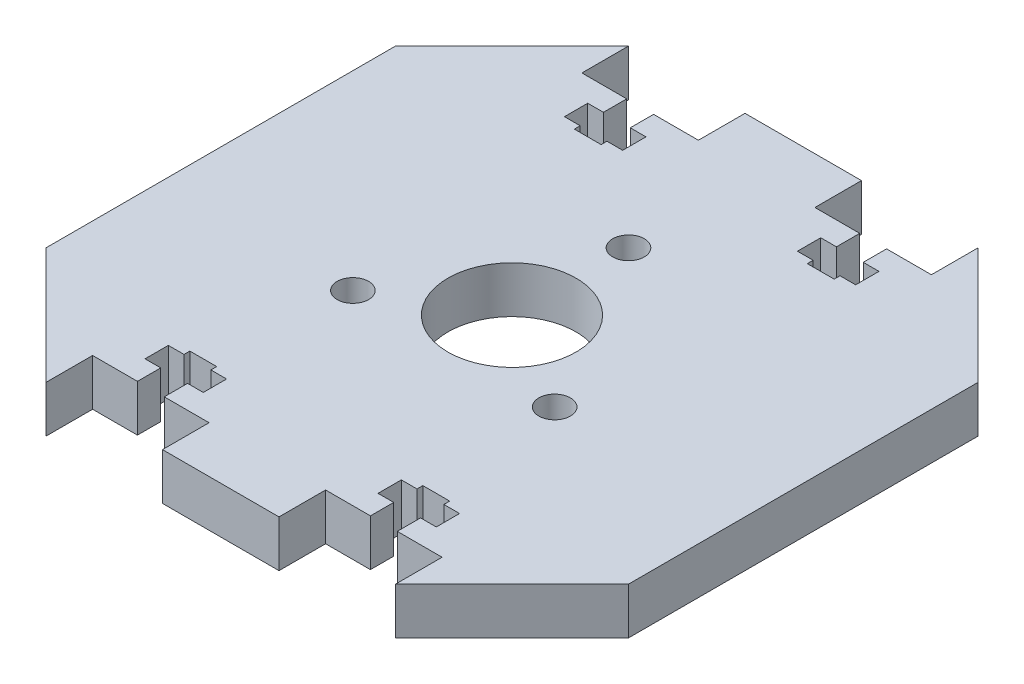
from build123d import *

# Parameters (mm, degrees)
SKETCH1_R           = 2.15265
SKETCH1_R_2         = 8.73125
BOSS_EXTRUDE1_DEPTH = 6.35
CUT_EXTRUDE1_DEPTH  = 57.484668827


with BuildPart() as part:
    # Sketch1 → Boss-Extrude1 (new body)
    with BuildSketch(Plane(origin=(0, 0, 0), x_dir=(1, 0, 0), z_dir=(0, 1, 0))):
        Polygon((23.8125, 39.6875), (-23.8125, 39.6875), (-39.6875, 23.8125), (-39.6875, -23.8125), (-23.8125, -39.6875), (23.8125, -39.6875), (39.6875, -23.8125), (39.6875, 23.8125), align=None)
        with Locations(Location((-13.748153285, -7.9375, 0), (0, 0, 270))):
            Circle(SKETCH1_R, mode=Mode.SUBTRACT)
        with Locations(Location((13.748153285, -7.9375, 0), (0, 0, 270))):
            Circle(SKETCH1_R, mode=Mode.SUBTRACT)
        with Locations(Location((0, 0, 0), (0, 0, 270))):
            Circle(SKETCH1_R_2, mode=Mode.SUBTRACT)
        with Locations(Location((0, 15.875, 0), (0, 0, 270))):
            Circle(SKETCH1_R, mode=Mode.SUBTRACT)
    extrude(amount=BOSS_EXTRUDE1_DEPTH)

    # Sketch2 → Cut-Extrude1 (cut, through all)
    with BuildSketch(Plane(origin=(0, 6.35, 0), x_dir=(1, 0, 0), z_dir=(0, 1, 0))):
        Polygon((-7.9375, 39.6875), (-23.8125, 39.6875), (-23.8125, 33.3375), (-17.7038, 33.3375), (-17.7038, 30.1625), (-19.84375, 30.1625), (-19.84375, 26.9875), (-17.7038, 26.9875), (-17.7038, 26.19375), (-14.0462, 26.19375), (-14.0462, 26.9875), (-11.90625, 26.9875), (-11.90625, 30.1625), (-14.0462, 30.1625), (-14.0462, 33.3375), (-7.9375, 33.3375), align=None)
        Polygon((23.8125, 39.6875), (7.9375, 39.6875), (7.9375, 33.3375), (14.0462, 33.3375), (14.0462, 30.1625), (11.90625, 30.1625), (11.90625, 26.9875), (14.0462, 26.9875), (14.0462, 26.19375), (17.7038, 26.19375), (17.7038, 26.9875), (19.84375, 26.9875), (19.84375, 30.1625), (17.7038, 30.1625), (17.7038, 33.3375), (23.8125, 33.3375), align=None)
        Polygon((-23.8125, -33.3375), (-23.8125, -39.6875), (-7.9375, -39.6875), (-7.9375, -33.3375), (-14.0462, -33.3375), (-14.0462, -30.1625), (-11.90625, -30.1625), (-11.90625, -26.9875), (-14.0462, -26.9875), (-14.0462, -26.19375), (-17.7038, -26.19375), (-17.7038, -26.9875), (-19.84375, -26.9875), (-19.84375, -30.1625), (-17.7038, -30.1625), (-17.7038, -33.3375), align=None)
        Polygon((7.9375, -33.3375), (7.9375, -39.6875), (23.8125, -39.6875), (23.8125, -33.3375), (17.7038, -33.3375), (17.7038, -30.1625), (19.84375, -30.1625), (19.84375, -26.9875), (17.7038, -26.9875), (17.7038, -26.19375), (14.0462, -26.19375), (14.0462, -26.9875), (11.90625, -26.9875), (11.90625, -30.1625), (14.0462, -30.1625), (14.0462, -33.3375), align=None)
    extrude(amount=-CUT_EXTRUDE1_DEPTH, mode=Mode.SUBTRACT)


solid = part.part
